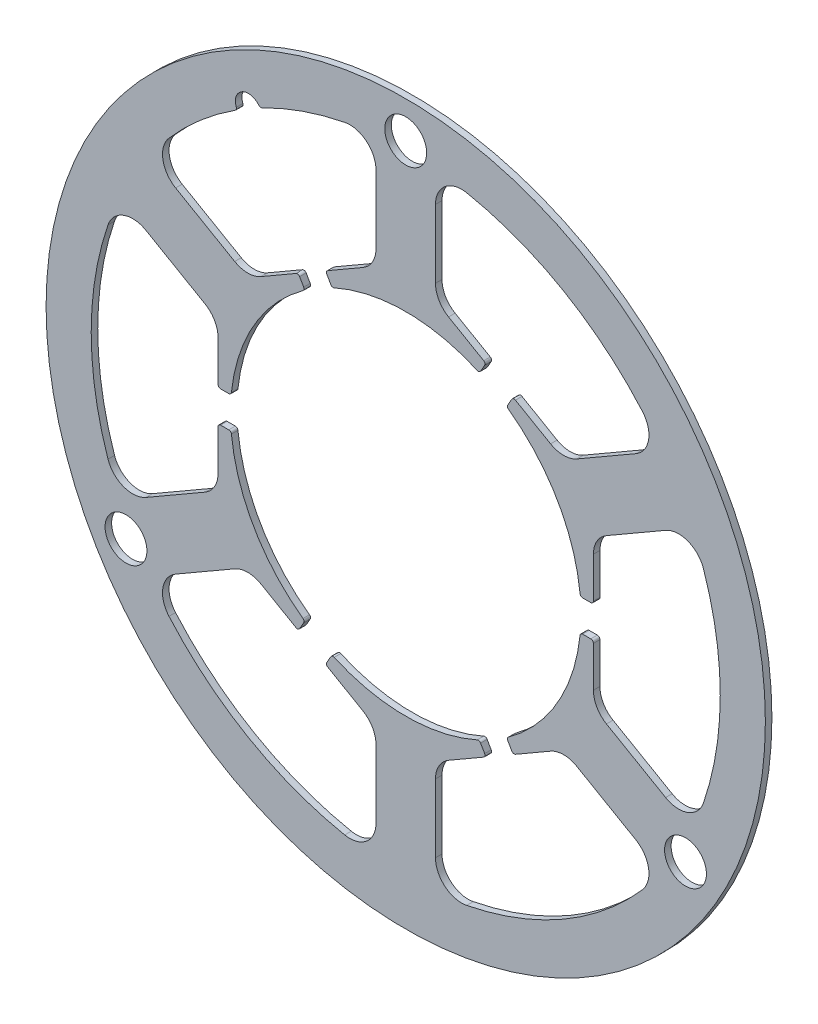
from build123d import *

# Parameters (mm, degrees)
IZIM1_R                     = 27.5
IZIM1_R_2                   = 1.6
Y_KSEKLIK_EKSTR_ZYON1_DEPTH = 0.5


with BuildPart() as part:
    # Çizim1 → Yükseklik-Ekstrüzyon1 (new body)
    with BuildSketch(Plane.XY):
        Circle(IZIM1_R)
        with Locations((0, 24.7)):
            Circle(IZIM1_R_2, mode=Mode.SUBTRACT)
        with Locations((21.390827473, -12.35)):
            Circle(IZIM1_R_2, mode=Mode.SUBTRACT)
        with Locations((-21.390827473, -12.35)):
            Circle(IZIM1_R_2, mode=Mode.SUBTRACT)
        with BuildLine():
            Line((5.962564435, 13.127464544), (3.275, 14.679130594))
            ThreePointArc((3.275, 14.679130594), (2.542949192, 15.411181402), (2.275, 16.411181402))
            Line((2.275, 16.411181402), (2.275, 21.631617485))
            ThreePointArc((2.275, 21.631617485), (3.00525794, 23.176853746), (4.662755102, 23.593668957))
            ThreePointArc((4.662755102, 23.593668957), (12.025, 20.827910961), (18.101339134, 15.834898849))
            ThreePointArc((18.101339134, 15.834898849), (18.569115153, 14.191056594), (17.596030267, 12.786016536))
            Line((17.596030267, 12.786016536), (13.075, 10.175798494))
            ThreePointArc((13.075, 10.175798494), (12.075, 9.907849302), (11.075, 10.175798494))
            Line((11.075, 10.175798494), (8.387435565, 11.727464544))
            ThreePointArc((8.387435565, 11.727464544), (8.235671756, 11.747444629), (8.114230485, 11.654259464))
            Line((8.114230485, 11.654259464), (7.803105114, 11.115374514))
            ThreePointArc((7.803105114, 11.115374514), (7.780713917, 10.973636087), (7.859011515, 10.853383712))
            ThreePointArc((7.859011515, 10.853383712), (11.604740669, 6.699999553), (13.328811876, 1.379410738))
            ThreePointArc((13.328811876, 1.379410738), (13.393804684, 1.251476831), (13.527749366, 1.199998958))
            Line((13.527749366, 1.199998958), (14.15, 1.199998958))
            ThreePointArc((14.15, 1.199998958), (14.291421356, 1.258577601), (14.35, 1.399998958))
            Line((14.35, 1.399998958), (14.35, 4.5033321))
            ThreePointArc((14.35, 4.5033321), (14.617949192, 5.5033321), (15.35, 6.235382907))
            Line((15.35, 6.235382907), (19.871030267, 8.845600949))
            ThreePointArc((19.871030267, 8.845600949), (21.574373094, 8.985797151), (22.764094236, 7.758770109))
            ThreePointArc((22.764094236, 7.758770109), (24.05, 0), (22.764094236, -7.758770109))
            ThreePointArc((22.764094236, -7.758770109), (21.574373094, -8.985797151), (19.871030267, -8.845600949))
            Line((19.871030267, -8.845600949), (15.35, -6.235382907))
            ThreePointArc((15.35, -6.235382907), (14.617949192, -5.5033321), (14.35, -4.5033321))
            Line((14.35, -4.5033321), (14.35, -1.400001042))
            ThreePointArc((14.35, -1.400001042), (14.291421356, -1.258579686), (14.15, -1.200001042))
            Line((14.15, -1.200001042), (13.527749151, -1.200001042))
            ThreePointArc((13.527749151, -1.200001042), (13.393804479, -1.251478906), (13.328811663, -1.379412792))
            ThreePointArc((13.328811663, -1.379412792), (11.604739636, -6.700001341), (7.859009843, -10.853384923))
            ThreePointArc((7.859009843, -10.853384923), (7.780712223, -10.973637301), (7.803103416, -11.115375743))
            Line((7.803103416, -11.115375743), (8.114228679, -11.654260506))
            ThreePointArc((8.114228679, -11.654260506), (8.235669951, -11.747445671), (8.38743376, -11.727465587))
            Line((8.38743376, -11.727465587), (11.075, -10.175798494))
            ThreePointArc((11.075, -10.175798494), (12.075, -9.907849302), (13.075, -10.175798494))
            Line((13.075, -10.175798494), (17.596030267, -12.786016536))
            ThreePointArc((17.596030267, -12.786016536), (18.569115153, -14.191056594), (18.101339134, -15.834898849))
            ThreePointArc((18.101339134, -15.834898849), (12.025, -20.827910961), (4.662755102, -23.593668957))
            ThreePointArc((4.662755102, -23.593668957), (3.00525794, -23.176853746), (2.275, -21.631617485))
            Line((2.275, -21.631617485), (2.275, -16.411181402))
            ThreePointArc((2.275, -16.411181402), (2.542949192, -15.411181402), (3.275, -14.679130594))
            Line((3.275, -14.679130594), (5.962562629, -13.127465587))
            ThreePointArc((5.962562629, -13.127465587), (6.055747795, -13.006024315), (6.03576771, -12.854260506))
            Line((6.03576771, -12.854260506), (5.724642232, -12.315375369))
            ThreePointArc((5.724642232, -12.315375369), (5.613088766, -12.225114815), (5.469798369, -12.23279632))
            ThreePointArc((5.469798369, -12.23279632), (-2.065e-06, -13.4), (-5.469802139, -12.232794634))
            ThreePointArc((-5.469802139, -12.232794634), (-5.613092563, -12.225113095), (-5.724646058, -12.315373658))
            Line((-5.724646058, -12.315373658), (-6.035771321, -12.854258421))
            ThreePointArc((-6.035771321, -12.854258421), (-6.055751405, -13.00602223), (-5.96256624, -13.127463502))
            Line((-5.96256624, -13.127463502), (-3.275, -14.679130594))
            ThreePointArc((-3.275, -14.679130594), (-2.542949192, -15.411181402), (-2.275, -16.411181402))
            Line((-2.275, -16.411181402), (-2.275, -21.631617485))
            ThreePointArc((-2.275, -21.631617485), (-3.00525794, -23.176853746), (-4.662755102, -23.593668957))
            ThreePointArc((-4.662755102, -23.593668957), (-12.025, -20.827910961), (-18.101339134, -15.834898849))
            ThreePointArc((-18.101339134, -15.834898849), (-18.569115153, -14.191056594), (-17.596030267, -12.786016536))
            Line((-17.596030267, -12.786016536), (-13.075, -10.175798494))
            ThreePointArc((-13.075, -10.175798494), (-12.075, -9.907849302), (-11.075, -10.175798494))
            Line((-11.075, -10.175798494), (-8.387437371, -11.727463502))
            ThreePointArc((-8.387437371, -11.727463502), (-8.235673562, -11.747443587), (-8.11423229, -11.654258421))
            Line((-8.11423229, -11.654258421), (-7.803106811, -11.115373285))
            ThreePointArc((-7.803106811, -11.115373285), (-7.780715611, -10.973634873), (-7.859013188, -10.853382501))
            ThreePointArc((-7.859013188, -10.853382501), (-11.604741185, -6.699998659), (-13.328811876, -1.379410738))
            ThreePointArc((-13.328811876, -1.379410738), (-13.393804684, -1.251476831), (-13.527749366, -1.199998958))
            Line((-13.527749366, -1.199998958), (-14.15, -1.199998958))
            ThreePointArc((-14.15, -1.199998958), (-14.291421356, -1.258577601), (-14.35, -1.399998958))
            Line((-14.35, -1.399998958), (-14.35, -4.5033321))
            ThreePointArc((-14.35, -4.5033321), (-14.617949192, -5.5033321), (-15.35, -6.235382907))
            Line((-15.35, -6.235382907), (-19.871030267, -8.845600949))
            ThreePointArc((-19.871030267, -8.845600949), (-21.574373094, -8.985797151), (-22.764094236, -7.758770109))
            ThreePointArc((-22.764094236, -7.758770109), (-24.05, 0), (-22.764094236, 7.758770109))
            ThreePointArc((-22.764094236, 7.758770109), (-21.574373094, 8.985797151), (-19.871030267, 8.845600949))
            Line((-19.871030267, 8.845600949), (-15.35, 6.235382907))
            ThreePointArc((-15.35, 6.235382907), (-14.617949192, 5.5033321), (-14.35, 4.5033321))
            Line((-14.35, 4.5033321), (-14.35, 1.400001042))
            ThreePointArc((-14.35, 1.400001042), (-14.291421356, 1.258579686), (-14.15, 1.200001042))
            Line((-14.15, 1.200001042), (-13.527749151, 1.200001042))
            ThreePointArc((-13.527749151, 1.200001042), (-13.393804479, 1.251478906), (-13.328811663, 1.379412792))
            ThreePointArc((-13.328811663, 1.379412792), (-11.604740153, 6.700000447), (-7.859011515, 10.853383712))
            ThreePointArc((-7.859011515, 10.853383712), (-7.780713917, 10.973636087), (-7.803105114, 11.115374514))
            Line((-7.803105114, 11.115374514), (-8.114230485, 11.654259464))
            ThreePointArc((-8.114230485, 11.654259464), (-8.235671756, 11.747444629), (-8.387435565, 11.727464544))
            Line((-8.387435565, 11.727464544), (-11.075, 10.175798494))
            ThreePointArc((-11.075, 10.175798494), (-12.075, 9.907849302), (-13.075, 10.175798494))
            Line((-13.075, 10.175798494), (-17.596030267, 12.786016536))
            ThreePointArc((-17.596030267, 12.786016536), (-18.569115153, 14.191056594), (-18.101339134, 15.834898849))
            ThreePointArc((-18.101339134, 15.834898849), (-15.719264288, 18.201846891), (-13.030721544, 20.213925795))
            ThreePointArc((-13.030721544, 20.213925795), (-12.948542196, 20.32125171), (-12.953404277, 20.456339302))
            ThreePointArc((-12.953404277, 20.456339302), (-12.525, 21.693936365), (-11.239007365, 21.44614682))
            ThreePointArc((-11.239007365, 21.44614682), (-11.12444912, 21.374392338), (-10.990412477, 21.391898784))
            ThreePointArc((-10.990412477, 21.391898784), (-7.903629659, 22.714205648), (-4.662755102, 23.593668957))
            ThreePointArc((-4.662755102, 23.593668957), (-3.00525794, 23.176853746), (-2.275, 21.631617485))
            Line((-2.275, 21.631617485), (-2.275, 16.411181402))
            ThreePointArc((-2.275, 16.411181402), (-2.542949192, 15.411181402), (-3.275, 14.679130594))
            Line((-3.275, 14.679130594), (-5.962564435, 13.127464544))
            ThreePointArc((-5.962564435, 13.127464544), (-6.0557496, 13.006023273), (-6.035769515, 12.854259464))
            Line((-6.035769515, 12.854259464), (-5.724644145, 12.315374514))
            ThreePointArc((-5.724644145, 12.315374514), (-5.613090664, 12.225113955), (-5.469800254, 12.232795477))
            ThreePointArc((-5.469800254, 12.232795477), (0, 13.4), (5.469800254, 12.232795477))
            ThreePointArc((5.469800254, 12.232795477), (5.613090664, 12.225113955), (5.724644145, 12.315374514))
            Line((5.724644145, 12.315374514), (6.035769515, 12.854259464))
            ThreePointArc((6.035769515, 12.854259464), (6.0557496, 13.006023273), (5.962564435, 13.127464544))
        make_face(mode=Mode.SUBTRACT)
    extrude(amount=Y_KSEKLIK_EKSTR_ZYON1_DEPTH)


solid = part.part
